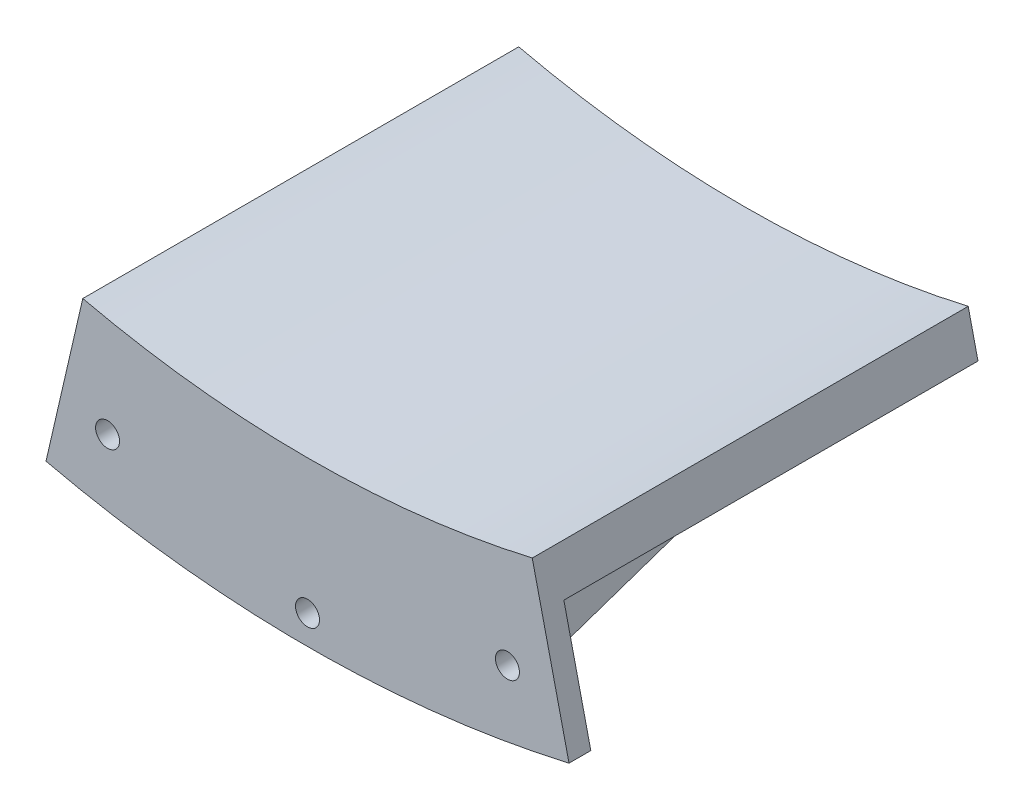
from build123d import *
from build123d.topology import SkipClean

# Parameters (mm, degrees)
EXTRUDE_1_DEPTH     = 60
EXTRUDE_START       = -3
EXTRUDE_2_DEPTH     = 3
EXTRUDE_START_2     = 57
SKETCH_3_R          = 1.65
EXTRUDE_3_DEPTH     = 57
SKETCH_4_R          = 1.65
CUT_EXTRUDE_1_DEPTH = 175.629425377


with BuildPart() as part:
    # 草图1 → 凸台-拉伸1 (new body)
    with BuildSketch(Plane.XY):
        with BuildLine():
            ThreePointArc((0, -143.5), (16.244661176, -142.57756129), (32.280476298, -139.822104297))
            Line((32.280476298, -139.822104297), (30.930769972, -133.975883908))
            ThreePointArc((30.930769972, -133.975883908), (15.565441893, -136.616130156), (0, -137.5))
            Line((0, -137.5), (0, -143.5))
        make_face()
        with BuildLine():
            Line((-30.930769972, -133.975883908), (-32.280476298, -139.822104297))
            ThreePointArc((-32.280476298, -139.822104297), (-16.244661176, -142.57756129), (0, -143.5))
            Line((0, -143.5), (0, -137.5))
            ThreePointArc((0, -137.5), (-15.565441893, -136.616130156), (-30.930769972, -133.975883908))
        make_face()
    extrude(amount=EXTRUDE_1_DEPTH)

    # 草图2 → 凸台-拉伸2 (add)
    with BuildSketch(Plane.XY.offset(60).offset(EXTRUDE_START)):
        with BuildLine():
            Line((35.992168695, -155.899210366), (32.280476298, -139.822104297))
            ThreePointArc((32.280476298, -139.822104297), (0, -143.5), (-32.280476298, -139.822104297))
            Line((-32.280476298, -139.822104297), (-35.992168695, -155.899210366))
            ThreePointArc((-35.992168695, -155.899210366), (0, -160), (35.992168695, -155.899210366))
        make_face()
    extrude(amount=EXTRUDE_2_DEPTH)

    # 草图3 → 凸台-拉伸3 (add)
    with SkipClean():  # the faces are left unmerged after this step: merging them gives an invalid solid
        with BuildSketch(Plane(origin=(0, 0, 57), x_dir=(-1, 0, 0), z_dir=(0, 0, -1)).offset(EXTRUDE_START_2)):
            with Locations(Location((-27.517564349, -148.471491042, 0), (0, 0, 180))):
                Circle(SKETCH_3_R)
            with Locations(Location((0, -156, 0), (0, 0, 180))):
                Circle(SKETCH_3_R)
            with BuildLine():
                Line((-16.169007549, -159.180913413), (-14.501578646, -142.765381717))
                ThreePointArc((-14.501578646, -142.765381717), (-17.239636373, -142.460678567), (-19.971339988, -142.103467864))
                Line((-19.971339988, -142.103467864), (-22.267696154, -158.442890999))
                ThreePointArc((-22.267696154, -158.442890999), (-19.221894214, -158.841174709), (-16.169007549, -159.180913413))
            make_face()
            with BuildLine():
                ThreePointArc((19.971339988, -142.103467864), (17.239636373, -142.460678567), (14.501578646, -142.765381717))
                Line((14.501578646, -142.765381717), (16.169007549, -159.180913413))
                ThreePointArc((16.169007549, -159.180913413), (19.221894214, -158.841174709), (22.267696154, -158.442890999))
                Line((22.267696154, -158.442890999), (19.971339988, -142.103467864))
            make_face()
            with Locations(Location((27.517564349, -148.471491042, 0), (0, 0, 180))):
                Circle(SKETCH_3_R)
        extrude(amount=-EXTRUDE_3_DEPTH)

    # 草图4 → 切除-拉伸1 (cut, through all)
    with SkipClean():  # the faces are left unmerged after this step: merging them gives an invalid solid
        with BuildSketch(Plane(origin=(0, 0, 0), x_dir=(-1, 0, 0), z_dir=(0, 0, -1))):
            with Locations((-27.517564349, -148.471491042)):
                Circle(SKETCH_4_R)
            with Locations((0, -156)):
                Circle(SKETCH_4_R)
            with Locations((27.517564349, -148.471491042)):
                Circle(SKETCH_4_R)
        extrude(amount=-CUT_EXTRUDE_1_DEPTH, mode=Mode.SUBTRACT)

    # 草图6 → 切除-旋转1 (revolve, cut)
    with BuildSketch(Plane(origin=(0, 0, 0), x_dir=(0, 0, -1), z_dir=(0.9902680687415703, 0.13917310096006566, 0))):
        Polygon((0, -143.5), (-57, -160), (0, -160), align=None)
    revolve(axis=Axis((0, 0, 60), (0, 0, -1)), mode=Mode.SUBTRACT)


solid = part.part
